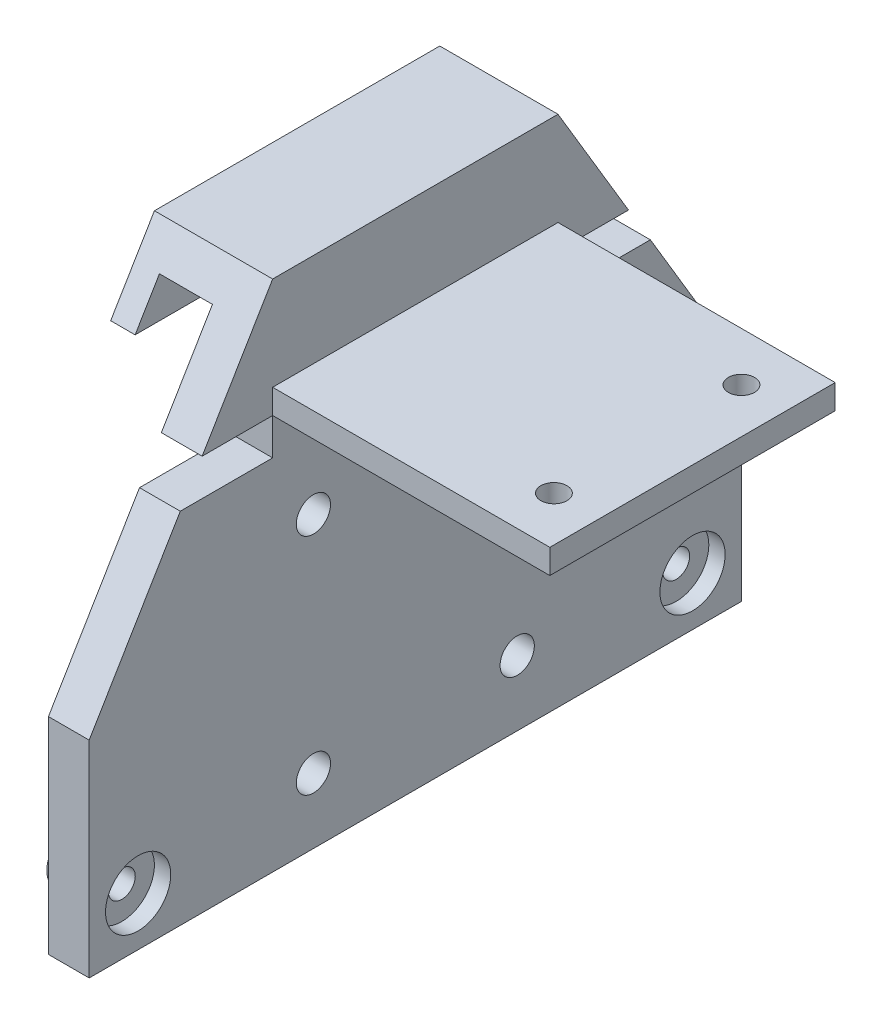
from build123d import *

# Parameters (mm, degrees)
SKETCH_1_W          = 80
SKETCH_1_H          = 63
SKETCH_1_R          = 1.65
EXTRUDE_1_DEPTH     = 10
SKETCH_2_R          = 4
CUT_EXTRUDE_1_DEPTH = 7
SKETCH_3_W          = 80
SKETCH_3_H          = 63
CUT_EXTRUDE_2_DEPTH = 5
EXTRUDE_START       = 3
SKETCH_4_R          = 3.2
SKETCH_4_R_2        = 1.65
EXTRUDE_2_DEPTH     = 3
EXTRUDE_3_DEPTH     = 80
CUT_EXTRUDE_3_DEPTH = 53.93864373
SKETCH_7_R          = 2.1
CUT_EXTRUDE_4_DEPTH = 53.93864373
SKETCH_8_R          = 2.1
CUT_EXTRUDE_5_DEPTH = 52.79285665
CUT_EXTRUDE_6_REACH = 54.939
SKETCH_9_W          = 17.196538702
SKETCH_9_H          = 4.5
SKETCH_10_W         = 35
SKETCH_10_H         = 3
EXTRUDE_4_DEPTH     = 34
SKETCH_11_R         = 1.6
CUT_EXTRUDE_7_DEPTH = 76.981905741


with BuildPart() as part:
    # 草图1 → 凸台-拉伸1 (new body)
    with BuildSketch(Plane(origin=(0, 0, 0), x_dir=(0, 0, -1), z_dir=(1, 0, 0))):
        Rectangle(SKETCH_1_W, SKETCH_1_H)
        with Locations((-34, -25.5)):
            Circle(SKETCH_1_R, mode=Mode.SUBTRACT)
        with Locations((34, -25.5)):
            Circle(SKETCH_1_R, mode=Mode.SUBTRACT)
    extrude(amount=EXTRUDE_1_DEPTH)

    # 草图2 → 切除-拉伸1 (cut)
    with BuildSketch(Plane(origin=(10, 0, 0), x_dir=(0, 0, -1), z_dir=(1, 0, 0))):
        with Locations((-34, -25.5)):
            Circle(SKETCH_2_R)
        with Locations((34, -25.5)):
            Circle(SKETCH_2_R)
    extrude(amount=-CUT_EXTRUDE_1_DEPTH, mode=Mode.SUBTRACT)

    # 草图3 → 切除-拉伸2 (cut)
    with BuildSketch(Plane(origin=(10, 0, 0), x_dir=(0, 0, -1), z_dir=(1, 0, 0))):
        Rectangle(SKETCH_3_W, SKETCH_3_H)
    extrude(amount=-CUT_EXTRUDE_2_DEPTH, mode=Mode.SUBTRACT)

    # 草图4 → 凸台-拉伸2 (add)
    # profile 1 of 2: a face of its own
    with BuildSketch(Plane.ZY.offset(EXTRUDE_START)):
        with Locations(Location((-34, -25.5, 0), (0, 0, 180))):
            Circle(SKETCH_4_R)
        with Locations((-34, -25.5)):
            Circle(SKETCH_4_R_2, mode=Mode.SUBTRACT)
    # profile 2 of 2: a face of its own
    with BuildSketch(Plane.ZY.offset(EXTRUDE_START)):
        with Locations(Location((34, -25.5, 0), (0, 0, 180))):
            Circle(SKETCH_4_R)
        with Locations((34, -25.5)):
            Circle(SKETCH_4_R_2, mode=Mode.SUBTRACT)
    extrude(amount=-EXTRUDE_2_DEPTH)

    # 草图5 → 凸台-拉伸3 (add)
    with BuildSketch(Plane.XY.offset(40)):
        Polygon((-6.5, 27.5), (-6.5, 22.5), (-9.5, 22.5), (-9.5, 31.5), (-6.5, 31.5), (0, 31.5), (0, 27.5), align=None)
    extrude(amount=-EXTRUDE_3_DEPTH)

    # 草图6 → 切除-拉伸3 (cut, through all)
    with BuildSketch(Plane(origin=(5, 0, 0), x_dir=(0, 0, -1), z_dir=(1, 0, 0))):
        Polygon((-17.5, 31.5), (-40, -6.231477094), (-40, 31.5), align=None)
        Polygon((17.5, 31.5), (40, 31.5), (40, -6.231477094), align=None)
    extrude(amount=-CUT_EXTRUDE_3_DEPTH, mode=Mode.SUBTRACT)

    # 草图7 → 切除-拉伸4 (cut, through all)
    with BuildSketch(Plane(origin=(5, 0, 0), x_dir=(0, 0, -1), z_dir=(1, 0, 0))):
        with Locations((-12.5, 4)):
            Circle(SKETCH_7_R)
        with Locations((12.5, 4)):
            Circle(SKETCH_7_R)
    extrude(amount=-CUT_EXTRUDE_4_DEPTH, mode=Mode.SUBTRACT)

    # 草图8 → 切除-拉伸5 (cut, through all)
    with BuildSketch(Plane.ZY):
        with Locations((-12.5, -23.5)):
            Circle(SKETCH_8_R)
        with Locations((12.5, -23.5)):
            Circle(SKETCH_8_R)
    extrude(amount=-CUT_EXTRUDE_5_DEPTH, mode=Mode.SUBTRACT)

    # 草图9 → 切除-拉伸6 (cut, up to next)
    with BuildSketch(Plane(origin=(5, 0, 0), x_dir=(0, 0, -1), z_dir=(1, 0, 0)), mode=Mode.PRIVATE) as cut_extrude_6_sk1:
        with Locations((26.098269351, 14.75)):
            Rectangle(SKETCH_9_W, SKETCH_9_H)
    cut_extrude_6_tool1 = extrude(cut_extrude_6_sk1.sketch, amount=-CUT_EXTRUDE_6_REACH, mode=Mode.PRIVATE) & part.part
    # 草图9 → 切除-拉伸6 (cut, up to next)
    with BuildSketch(Plane(origin=(5, 0, 0), x_dir=(0, 0, -1), z_dir=(1, 0, 0)), mode=Mode.PRIVATE) as cut_extrude_6_sk2:
        with Locations((-26.098269351, 14.75)):
            Rectangle(SKETCH_9_W, SKETCH_9_H)
    cut_extrude_6_tool2 = extrude(cut_extrude_6_sk2.sketch, amount=-CUT_EXTRUDE_6_REACH, mode=Mode.PRIVATE) & part.part
    add(cut_extrude_6_tool1.solids().sort_by_distance((5, 14.75, -26.098269))[0], mode=Mode.SUBTRACT)
    add(cut_extrude_6_tool2.solids().sort_by_distance((5, 14.75, 26.098269))[0], mode=Mode.SUBTRACT)

    # 草图10 → 凸台-拉伸4 (add)
    with BuildSketch(Plane(origin=(5, 0, 0), x_dir=(0, 0, -1), z_dir=(1, 0, 0))):
        with Locations((0, 18.5)):
            Rectangle(SKETCH_10_W, SKETCH_10_H)
    extrude(amount=EXTRUDE_4_DEPTH)

    # 草图11 → 切除-拉伸7 (cut, through all)
    with BuildSketch(Plane(origin=(0, 20, 0), x_dir=(1, 0, 0), z_dir=(0, 1, 0))):
        with Locations(Location((33.5, 11.5, 0), (0, 0, 270))):
            Circle(SKETCH_11_R)
        with Locations(Location((33.5, -11.5, 0), (0, 0, 270))):
            Circle(SKETCH_11_R)
    extrude(amount=-CUT_EXTRUDE_7_DEPTH, mode=Mode.SUBTRACT)


solid = part.part
